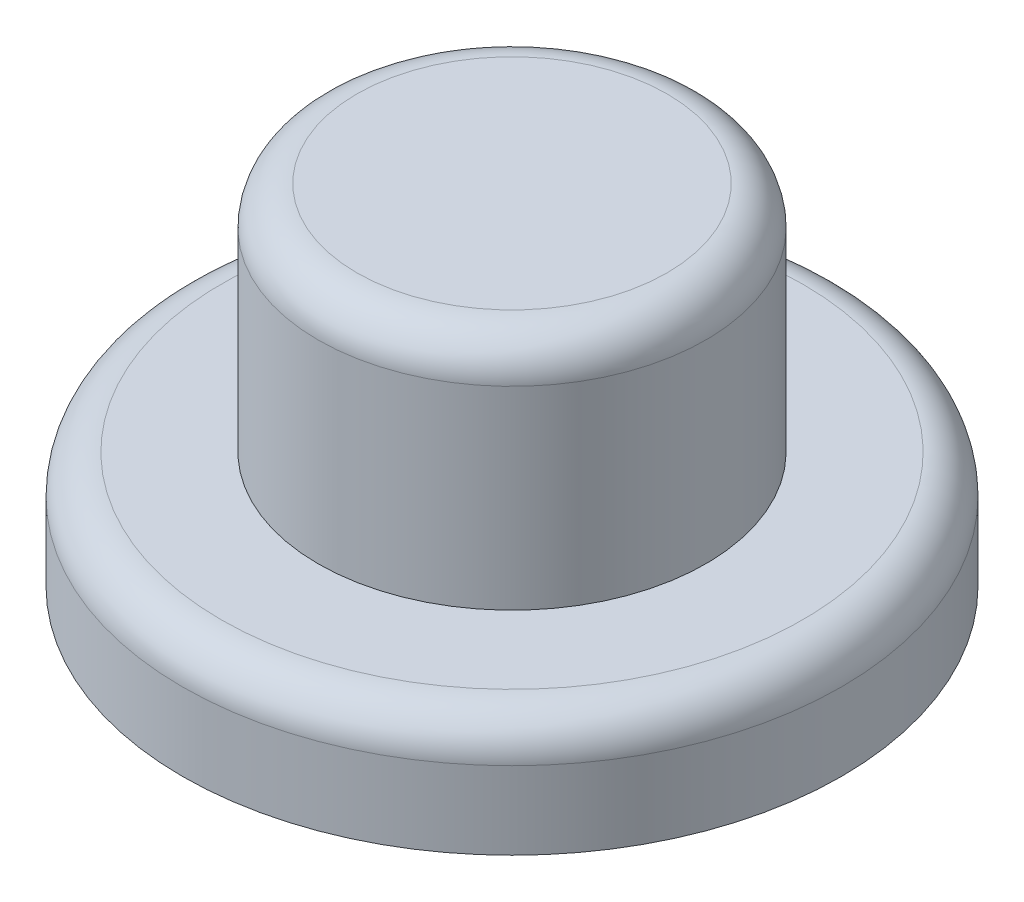
from build123d import *

# Parameters (mm, degrees)
SKETCH1_R           = 8.5
BOSS_EXTRUDE1_DEPTH = 3
FILLET2_R           = 1
SKETCH2_R           = 5
BOSS_EXTRUDE3_DEPTH = 6
FILLET4_R           = 1


with BuildPart() as part:
    # Sketch1 → Boss-Extrude1 (new body)
    with BuildSketch(Plane(origin=(0, 0, 0), x_dir=(1, 0, 0), z_dir=(0, 1, 0))):
        with Locations(Location((-51.120170416, 0, 0), (0, 0, 270))):
            Circle(SKETCH1_R)
    extrude(amount=BOSS_EXTRUDE1_DEPTH)

    # Fillet2
    fillet2_edges = [part.edges().sort_by_distance(p)[0] for p in [
        (-51.120170416, 3, -8.5),
    ]]
    fillet(fillet2_edges, radius=FILLET2_R)

    # Sketch2 → Boss-Extrude3 (add)
    with BuildSketch(Plane(origin=(0, 3, 0), x_dir=(1, 0, 0), z_dir=(0, 1, 0))):
        with Locations(Location((-51.120170416, 0, 0), (0, 0, 270))):
            Circle(SKETCH2_R)
    extrude(amount=BOSS_EXTRUDE3_DEPTH)

    # Fillet4
    fillet4_edges = [part.edges().sort_by_distance(p)[0] for p in [
        (-51.120170416, 9, -5),
    ]]
    fillet(fillet4_edges, radius=FILLET4_R)


solid = part.part
